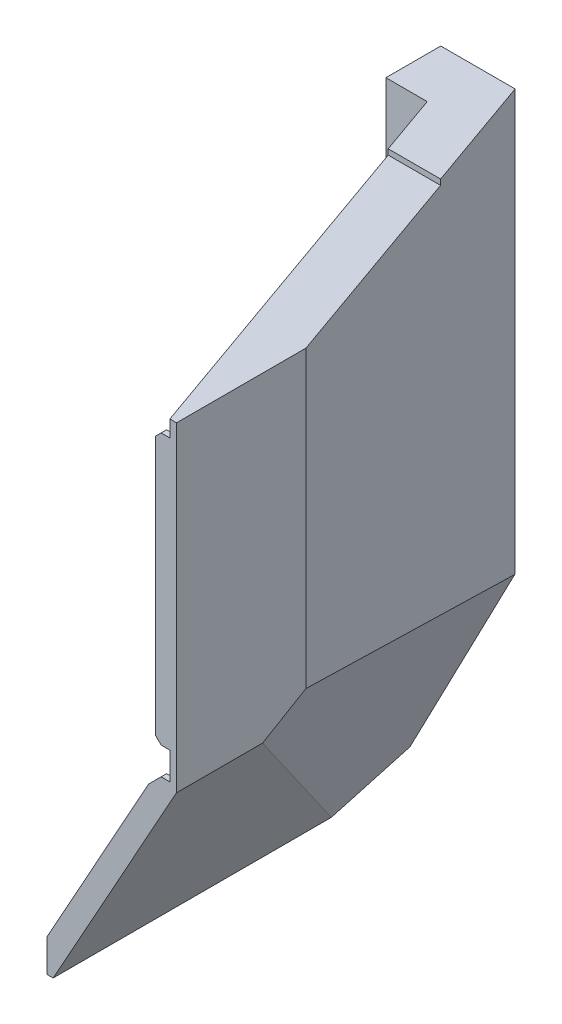
from build123d import *
from OCP.BRepFilletAPI import BRepFilletAPI_MakeChamfer

# Parameters (mm, degrees)
BOSS_EXTRU_2_DEPTH            = 850
ESQUISSE2_W                   = 135.455554094
ESQUISSE2_H                   = 850
BOSS_EXTRU_4_DEPTH            = 100
ESQUISSE7_W                   = 615
ESQUISSE7_H                   = 10
ENL_V_MAT_EXTRU_5_DEPTH       = 1260.158602645
ENL_V_MAT_EXTRU_6_DEPTH       = 1237.105055174
CHANFREIN1_SIZE               = 40
CHANFREIN1_SIZE2              = 104.203562588
CHANFREIN2_SIZE               = 50
CHANFREIN2_SIZE2              = 86.602540378
CHANFREIN3_SIZE               = 250
CHANFREIN3_SIZE2              = 81.394715296
ENL_V_MAT_EXTRU_9_DEPTH       = 20
BOSS_EXTRU_5_DEPTH            = 20
BOSS_EXTRU_6_DEPTH            = 20
BOSS_EXTRU_7_DEPTH            = 20
BOSS_EXTRU_8_REACH            = 1235.856
BOSS_EXTRU_14_REACH           = 1078.841
ENL_V_MAT_EXTRU_11_DEPTH      = 1231.067968745
ENL_V_MAT_EXTRU_11_DEPTH_BACK = 1231.067968745
ESQUISSE20_W                  = 36.798592216
ESQUISSE20_H                  = 35.835276246
ENL_V_MAT_EXTRU_10_DEPTH      = 1231.067968745
ENL_V_MAT_EXTRU_10_DEPTH_BACK = 1231.067968745
BOSS_EXTRU_15_DEPTH           = 10
ENL_V_MAT_EXTRU_12_DEPTH      = 1231.067968745
BOSS_EXTRU_17_DEPTH           = 10
ENL_V_MAT_EXTRU_13_DEPTH      = 10
CHANFREIN6_SIZE               = 10
CHANFREIN6_SIZE2              = 25.739216822
ENL_V_MAT_EXTRU_7_DEPTH       = 20
ESQUISSE28_W                  = 50.106872135
ESQUISSE28_H                  = 235.71179502
ENL_V_MAT_EXTRU_15_DEPTH      = 1231.067968745


with BuildPart() as part:
    # Esquisse1 → Boss.-Extru.2 (new body)
    with BuildSketch(Plane(origin=(0, 0, 0), x_dir=(1, 0, 0), z_dir=(0, 1, 0))):
        Polygon((0, 0), (95.455554093, 0), (-196.119788372, 825), (-291.575342466, 825), align=None)
    extrude(amount=BOSS_EXTRU_2_DEPTH)

    # Esquisse2 → Boss.-Extru.4 (add)
    with BuildSketch(Plane(origin=(0, 0, -825), x_dir=(-1, 0, 0), z_dir=(0, 0, -1))):
        with Locations((263.847565419, 425)):
            Rectangle(ESQUISSE2_W, ESQUISSE2_H)
    extrude(amount=-BOSS_EXTRU_4_DEPTH)

    # Esquisse7 → Enlèv. mat.-Extru.5 (cut, through all)
    with BuildSketch(Plane.ZY.offset(331.575342466)):
        with Locations((-307.5, 845)):
            Rectangle(ESQUISSE7_W, ESQUISSE7_H)
    extrude(amount=-ENL_V_MAT_EXTRU_5_DEPTH, mode=Mode.SUBTRACT)

    # Esquisse8 → Enlèv. mat.-Extru.6 (cut, through all)
    with BuildSketch(Plane(origin=(84.856246207, 0, -29.990289755), x_dir=(-0.3332254417270876, 0, -0.9428471800805194), z_dir=(0.9428471800805194, 0, -0.3332254417270876))):
        Polygon((-31.808219178, 280), (768.947519086, 0), (-31.808219178, 0), align=None)
    extrude(amount=-ENL_V_MAT_EXTRU_6_DEPTH, mode=Mode.SUBTRACT)

    # Chanfrein1
    chanfrein1_edges = [part.edges().sort_by_distance(p)[0] for p in [
        (-37.960538206, 140, -377.495144878),
    ]]
    chanfrein1_side = [part.faces().sort_by_distance(p)[0] for p in [
        (-82.734004125, 137.238189401, -370.048215647),
    ]]
    chamfer(chanfrein1_edges, length=CHANFREIN1_SIZE, length2=CHANFREIN1_SIZE2, reference=chanfrein1_side[0])

    # Chanfrein2
    chanfrein2_edges = [part.edges().sort_by_distance(p)[0] for p in [
        (-279.375357295, 0, -825),
    ]]
    chanfrein2_side = [part.faces().sort_by_distance(p)[0] for p in [
        (-275.691218494, 0, -775.06397156),
    ]]
    chamfer(chanfrein2_edges, length=CHANFREIN2_SIZE, length2=CHANFREIN2_SIZE2, reference=chanfrein2_side[0])

    # Chanfrein3
    chanfrein3_edges = [part.edges().sort_by_distance(p)[0] for p in [
        (95.455554093, 615.195164523, 0),
    ]]
    chanfrein3_side = [part.faces().sort_by_distance(p)[0] for p in [
        (-63.074276605, 533.547742021, -448.553396936),
    ]]
    chamfer(chanfrein3_edges, length=CHANFREIN3_SIZE, length2=CHANFREIN3_SIZE2, reference=chanfrein3_side[0])

    # Esquisse11 → Enlèv. mat.-Extru.9 (cut)
    with BuildSketch(Plane(origin=(0, 0, -825), x_dir=(-1, 0, 0), z_dir=(0, 0, -1))):
        with BuildLine():
            Line((273.165439889, 663.862320377), (222.709885796, 714.31787447))
            ThreePointArc((222.709885796, 714.31787447), (222.709885796, 746.137679623), (254.529690949, 746.137679623))
            Line((254.529690949, 746.137679623), (304.985245042, 695.68212553))
            ThreePointArc((304.985245042, 695.68212553), (304.985245042, 663.862320377), (273.165439889, 663.862320377))
        make_face()
        with BuildLine():
            Line((273.165439889, 523.862320377), (222.709885796, 574.31787447))
            ThreePointArc((222.709885796, 574.31787447), (222.709885796, 606.137679623), (254.529690949, 606.137679623))
            Line((254.529690949, 606.137679623), (304.985245042, 555.68212553))
            ThreePointArc((304.985245042, 555.68212553), (304.985245042, 523.862320377), (273.165439889, 523.862320377))
        make_face()
        with BuildLine():
            Line((273.165439889, 383.862320377), (222.709885796, 434.31787447))
            ThreePointArc((222.709885796, 434.31787447), (222.709885796, 466.137679623), (254.529690949, 466.137679623))
            Line((254.529690949, 466.137679623), (304.985245042, 415.68212553))
            ThreePointArc((304.985245042, 415.68212553), (304.985245042, 383.862320377), (273.165439889, 383.862320377))
        make_face()
        with BuildLine():
            Line((273.165439889, 243.862320377), (222.709885796, 294.31787447))
            ThreePointArc((222.709885796, 294.31787447), (222.709885796, 326.137679623), (254.529690949, 326.137679623))
            Line((254.529690949, 326.137679623), (304.985245042, 275.68212553))
            ThreePointArc((304.985245042, 275.68212553), (304.985245042, 243.862320377), (273.165439889, 243.862320377))
        make_face()
    extrude(amount=-ENL_V_MAT_EXTRU_9_DEPTH, mode=Mode.SUBTRACT)

    # Esquisse12 → Boss.-Extru.5 (add)
    with BuildSketch(Plane(origin=(-40.719657631, 14.978452192, 8.836336942), x_dir=(-0.1789623557208966, 0.09138543974154965, -0.9796025605509977), z_dir=(0.9196400605905344, -0.33828341108028354, -0.19956576045235425))):
        Polygon((758.2962151, -87.760898196), (129.510578012, 220.360980406), (128.5939647, -274.639019594), (551.387234827, -304.990440115), align=None)
    extrude(amount=-BOSS_EXTRU_5_DEPTH)

    # Esquisse13 → Boss.-Extru.6 (add)
    with BuildSketch(Plane(origin=(0, -335.584843966, -581.25), x_dir=(-1, 0, 0), z_dir=(0, -0.5000000000000013, -0.8660254037844379))):
        Polygon((331.575342466, 387.5), (216.325161863, 387.5), (331.575342466, -161.154885751), align=None)
    extrude(amount=-BOSS_EXTRU_6_DEPTH)

    # Esquisse14 → Boss.-Extru.7 (add)
    with BuildSketch(Plane(origin=(-40.719657631, 14.978452192, 8.836336942), x_dir=(0.18729623755068028, -0.06889566128781024, 0.9798844356632441), z_dir=(-0.9196400605905354, 0.33828341108028165, 0.19956576045235197))):
        Polygon((-558.543564559, -291.678140731), (-760.182954736, -69.548547185), (-765.904204326, -72.183872894), (-799.927326543, -74.681473645), (-671.74280044, -297.07939729), align=None)
    extrude(amount=BOSS_EXTRU_7_DEPTH)

    # Boss.-Extru.8: up to this face of the body (flat: up to its plane)
    boss_extru_8_end = Plane(part.part.faces().sort_by_distance((-164.532158793, -37.982859016, -371.724952169))[0])
    # Esquisse17 → Boss.-Extru.8 (add, up to the picked face)
    with BuildSketch(Plane(origin=(14.059914026, 0, -0.114027244), x_dir=(-0.008109828661301803, 0, -0.9999671147988239), z_dir=(0.999967114798824, 0, -0.008109828661301803)), mode=Mode.PRIVATE) as boss_extru_8_sk1:
        Polygon((0, 268.877630288), (0, -254.375489576), (124.880630316, -230.495880912), (112.743376241, 233.203159991), align=None)
    boss_extru_8_tool1 = split(extrude(boss_extru_8_sk1.sketch, amount=-BOSS_EXTRU_8_REACH, mode=Mode.PRIVATE), bisect_by=boss_extru_8_end, keep=Keep.BOTH, mode=Mode.PRIVATE)
    add(boss_extru_8_tool1.solids().sort_by(Axis((13.587491, -0.094835, -58.365221), (-0.999967114798824, 0, 0.008109828661301803)))[0])

    # Boss.-Extru.14: up to this face of the body (flat: up to its plane)
    boss_extru_14_end = Plane(part.part.faces().sort_by_distance((-146.671728248, -30.602018057, -301.931660273))[0])
    # Esquisse19 → Boss.-Extru.14 (add, up to the picked face)
    with BuildSketch(Plane(origin=(-27.916044034, 239.583966402, -78.987256375), x_dir=(-0.9939328490713287, -0.1044581087967751, 0.034438278754206304), z_dir=(0.1099885973042266, -0.9439555392983614, 0.31120804663599005)), mode=Mode.PRIVATE) as boss_extru_14_sk1:
        Polygon((-42.23311753, -84.700642173), (-41.849173409, -35.141174806), (202.602212611, 697.589071061), (229.71052108, 688.54527409), (-28.086448758, -84.187661354), align=None)
    boss_extru_14_tool1 = split(extrude(boss_extru_14_sk1.sketch, amount=BOSS_EXTRU_14_REACH, mode=Mode.PRIVATE), bisect_by=boss_extru_14_end, keep=Keep.BOTH, mode=Mode.PRIVATE)
    add(boss_extru_14_tool1.solids().sort_by(Axis((-116.11325, 133.026087, -371.027306), (0.1099885973042266, -0.9439555392983614, 0.31120804663599005)))[0])

    # Esquisse20 → Enlèv. mat.-Extru.11 (cut, two sides: drawn at the far end of the back side and taken through both)
    with BuildSketch(Plane(origin=(0, 0, 0), x_dir=(1, 0, 0), z_dir=(0, 1, 0)).offset(-ENL_V_MAT_EXTRU_11_DEPTH_BACK)):
        with Locations((-4.33845731, -17.917638123)):
            Rectangle(ESQUISSE20_W, ESQUISSE20_H)
    extrude(amount=ENL_V_MAT_EXTRU_11_DEPTH + ENL_V_MAT_EXTRU_11_DEPTH_BACK, mode=Mode.SUBTRACT)

    # Esquisse15 → Enlèv. mat.-Extru.10 (cut, two sides: drawn at the far end of the back side and taken through both)
    with BuildSketch(Plane.XY.offset(-ENL_V_MAT_EXTRU_10_DEPTH_BACK)):
        Polygon((-331.575342466, -190.149068971), (-331.575342466, -475.149068971), (14.059914026, -475.149068971), (14.059914026, -190.149068971), (55.846885337, -190.149068971), (55.846885337, 19.850931029), (55.846885337, 270.515982808), (14.060838798, 270.515982808), (14.060838798, 259.850931029), (-235.940085974, -190.149068971), align=None)
    extrude(amount=ENL_V_MAT_EXTRU_10_DEPTH + ENL_V_MAT_EXTRU_10_DEPTH_BACK, mode=Mode.SUBTRACT)

    # Esquisse21 → Boss.-Extru.15 (add)
    with BuildSketch(Plane(origin=(-99.569705588, 55.316707725, 0), x_dir=(0, 0, -1), z_dir=(0.8741565134833756, -0.4856443039247848, 0))):
        Polygon((321.424737861, -305.542159578), (543.068402305, -280.803005995), (155.773656423, 231.37758287), (0, 233.978950164), (0, 205.025992858), (0, -305.542159578), align=None)
    extrude(amount=-BOSS_EXTRU_15_DEPTH)

    # Esquisse23 → Enlèv. mat.-Extru.12 (cut, through all)
    with BuildSketch(Plane.XY):
        Polygon((-331.575342466, -190.149068971), (-331.575342466, -260.816411821), (-102.082537534, -260.816411821), (-102.082537534, -190.149068971), (-102.082537534, -148.149068971), (-331.575342466, -148.149068971), align=None)
    extrude(amount=-ENL_V_MAT_EXTRU_12_DEPTH, mode=Mode.SUBTRACT)

    # Esquisse26 → Boss.-Extru.17 (add)
    with BuildSketch(Plane.XY):
        Polygon((14.060838798, 810), (14.060838798, 317.576928865), (-25.939161202, 317.576928865), (-25.939161202, 810), (0, 810), (0, 840), (14.060838798, 840), align=None)
        Polygon((-25.939161202, 267.576928865), (14.060838798, 267.576928865), (12.797499589, 257.576928865), (-212.606666329, -148.149068971), (-224.046265355, -148.149068971), (-224.046265355, -89.014539546), align=None)
    extrude(amount=-BOSS_EXTRU_17_DEPTH)

    # Esquisse24 → Enlèv. mat.-Extru.13 (cut)
    with BuildSketch(Plane(origin=(14.059914026, 0, -0.114027244), x_dir=(-0.008109828661301803, 0, -0.9999671147988239), z_dir=(0.999967114798824, 0, -0.008109828661301803))):
        Polygon((-0.114030993, 259.850931029), (155.664748246, 257.576928865), (235.605515711, 302.972909907), (235.605515711, 840), (-0.114030993, 840), align=None)
    extrude(amount=ENL_V_MAT_EXTRU_13_DEPTH, mode=Mode.SUBTRACT)

    # Chanfrein6: one chamfer whose edges measure the first distance from different faces: ONE call of the kernel's chamfer builder (chamfer() names one face for all edges)
    chanfrein6_edges_1 = [part.edges().sort_by_distance(p)[0] for p in [
        (-25.939161202, 267.576928865, -5),
    ]]
    chanfrein6_side_1 = [part.faces().sort_by_distance(p)[0] for p in [
        (-13.831610998, 267.576928865, -4.878156509),
    ]]
    chanfrein6_edges_2 = [part.edges().sort_by_distance(p)[0] for p in [
        (-25.939161202, 810, -5),
        (-25.939161202, 317.576928865, -5),
    ]]
    chanfrein6 = BRepFilletAPI_MakeChamfer(part.part.solid().wrapped)
    for e in chanfrein6_edges_1:
        chanfrein6.Add(CHANFREIN6_SIZE, CHANFREIN6_SIZE2, e.wrapped, chanfrein6_side_1[0].wrapped)  # the first distance lies on this face
    for e in chanfrein6_edges_2:
        chanfrein6.Add(CHANFREIN6_SIZE, e.wrapped)
    add(Compound.cast(chanfrein6.Shape()), mode=Mode.REPLACE)

    # Esquisse9 → Enlèv. mat.-Extru.7 (cut)
    with BuildSketch(Plane(origin=(0, -335.584843966, -581.25), x_dir=(-1, 0, 0), z_dir=(0, -0.49999999999999656, -0.8660254037844407))):
        Polygon((311.575342466, 438.386921888), (226.072366588, 438.386921888), (236.575342466, 388.386921888), (311.575342466, 388.386921888), align=None)
        Polygon((311.575342466, 343.175811089), (246.072366588, 343.175811089), (256.575342466, 293.175811089), (311.575342466, 293.175811089), align=None)
    extrude(amount=-ENL_V_MAT_EXTRU_7_DEPTH, mode=Mode.SUBTRACT)

    # Esquisse28 → Enlèv. mat.-Extru.15 (cut, through all)
    with BuildSketch(Plane(origin=(0, 0, 0), x_dir=(1, 0, 0), z_dir=(0, 1, 0))):
        with Locations((37.20262973, 117.85589751)):
            Rectangle(ESQUISSE28_W, ESQUISSE28_H)
    extrude(amount=ENL_V_MAT_EXTRU_15_DEPTH, mode=Mode.SUBTRACT)


solid = part.part
